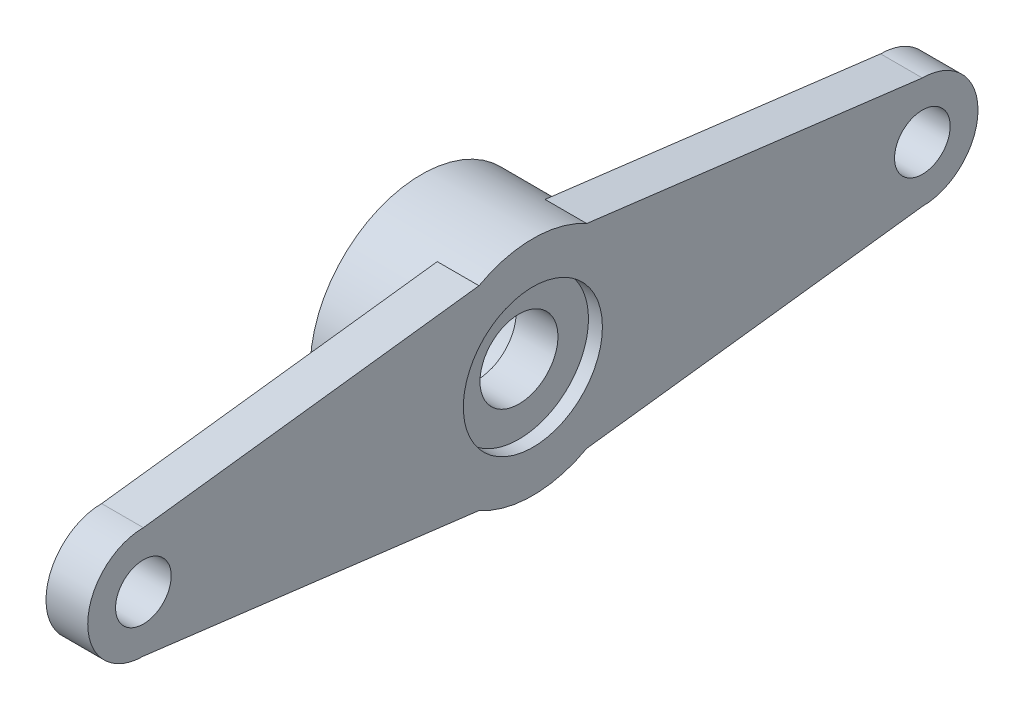
from build123d import *
from build123d.topology import SkipClean

# Parameters (mm, degrees)
SKETCH2_R           = 4
SKETCH2_R_2         = 2.5
BOSS_EXTRUDE1_DEPTH = 2.5
SKETCH3_R           = 2.5
SKETCH3_R_2         = 1
BOSS_EXTRUDE2_DEPTH = 1.5
SKETCH4_R           = 2.5
SKETCH4_R_2         = 1.400921988
BOSS_EXTRUDE3_DEPTH = 3.5
SKETCH6_R           = 2.5
CUT_EXTRUDE2_DEPTH  = 2


with BuildPart() as part:
    # Sketch2 → Boss-Extrude1 (new body)
    with BuildSketch(Plane(origin=(0, 0, 0), x_dir=(0, 0, -1), z_dir=(1, 0, 0))):
        Circle(SKETCH2_R)
        Circle(SKETCH2_R_2, mode=Mode.SUBTRACT)
    extrude(amount=BOSS_EXTRUDE1_DEPTH)

    # Sketch3 → Boss-Extrude2 (add)
    with SkipClean():  # the faces are left unmerged after this step: merging them gives an invalid solid
        with BuildSketch(Plane(origin=(2.5, 0, 0), x_dir=(0, 0, -1), z_dir=(1, 0, 0))):
            with BuildLine():
                Line((-1.936491673, -3.5), (-14, -2))
                ThreePointArc((-14, -2), (-16, 0), (-14, 2))
                Line((-14, 2), (-1.936491673, 3.5))
                ThreePointArc((-1.936491673, 3.5), (0, 4), (1.936491673, 3.5))
                Line((1.936491673, 3.5), (14, 2))
                ThreePointArc((14, 2), (16, 0), (14, -2))
                Line((14, -2), (1.936491673, -3.5))
                ThreePointArc((1.936491673, -3.5), (0, -4), (-1.936491673, -3.5))
            make_face()
            Circle(SKETCH3_R, mode=Mode.SUBTRACT)
            with Locations((-14, 0)):
                Circle(SKETCH3_R_2, mode=Mode.SUBTRACT)
            with Locations((14, 0)):
                Circle(SKETCH3_R_2, mode=Mode.SUBTRACT)
        extrude(amount=BOSS_EXTRUDE2_DEPTH)


with BuildPart() as body_2:
    # Sketch4 → Boss-Extrude3 (new body)
    with BuildSketch(Plane.ZY):
        Circle(SKETCH4_R)
        Circle(SKETCH4_R_2, mode=Mode.SUBTRACT)
    extrude(amount=-BOSS_EXTRUDE3_DEPTH)

    # Sketch6 → Cut-Extrude2 (cut)
    with BuildSketch(Plane.ZY):
        Circle(SKETCH6_R)
    extrude(amount=-CUT_EXTRUDE2_DEPTH, mode=Mode.SUBTRACT)


solid = Compound([part.part, body_2.part])
